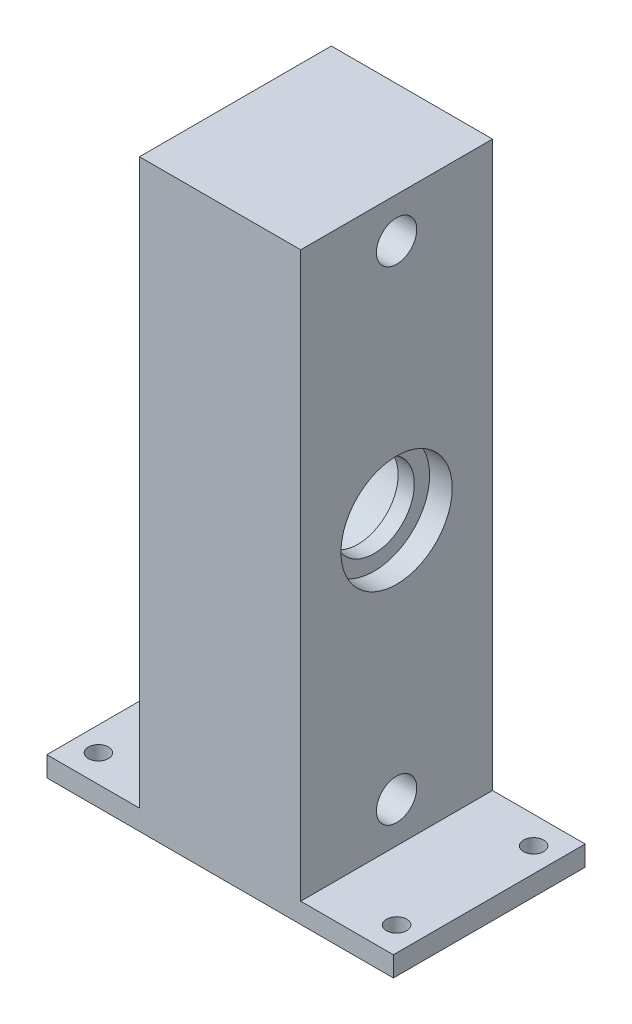
from build123d import *

# Parameters (mm, degrees)
SKETCH1_W           = 25.4
SKETCH1_H           = 88.9
BOSS_EXTRUDE1_DEPTH = 30.226
SKETCH2_R           = 3.175
CUT_EXTRUDE1_DEPTH  = 12.7
SKETCH3_R           = 8.763
CUT_EXTRUDE2_DEPTH  = 3.556
CUT_EXTRUDE3_START  = -21.844
SKETCH4_R           = 10.795
CUT_EXTRUDE3_DEPTH  = 21.844
SKETCH5_W           = 54.61
SKETCH5_H           = 30.226
BOSS_EXTRUDE2_DEPTH = 3.175
SKETCH6_R           = 1.5875
CUT_EXTRUDE4_DEPTH  = 3.175
BOSS_EXTRUDE3_START = 2.54
SKETCH8_R           = 10.795
SKETCH8_R_2         = 6.35
BOSS_EXTRUDE3_DEPTH = 2.54


with BuildPart() as part:
    # Sketch1 → Boss-Extrude1 (new body)
    with BuildSketch(Plane.XY):
        Rectangle(SKETCH1_W, SKETCH1_H)
    extrude(amount=BOSS_EXTRUDE1_DEPTH)

    # Sketch2 → Cut-Extrude1 (cut)
    with BuildSketch(Plane(origin=(12.7, 0, 0), x_dir=(0, 0, -1), z_dir=(1, 0, 0))):
        with Locations((-15.113, 38.1)):
            Circle(SKETCH2_R)
        with Locations((-15.113, -38.1)):
            Circle(SKETCH2_R)
    extrude(amount=-CUT_EXTRUDE1_DEPTH, mode=Mode.SUBTRACT)

    # Sketch3 → Cut-Extrude2 (cut)
    with BuildSketch(Plane(origin=(12.7, 0, 0), x_dir=(0, 0, -1), z_dir=(1, 0, 0))):
        with Locations((-15.113, 0)):
            Circle(SKETCH3_R)
    extrude(amount=-CUT_EXTRUDE2_DEPTH, mode=Mode.SUBTRACT)

    # Sketch4 → Cut-Extrude3 (cut)
    with BuildSketch(Plane(origin=(9.144, 0, 0), x_dir=(0, 0, -1), z_dir=(1, 0, 0)).offset(CUT_EXTRUDE3_START)):
        with Locations((-15.113, 0)):
            Circle(SKETCH4_R)
    extrude(amount=CUT_EXTRUDE3_DEPTH, mode=Mode.SUBTRACT)

    # Sketch5 → Boss-Extrude2 (add)
    with BuildSketch(Plane.XZ.offset(44.45)):
        with Locations((0, 15.113)):
            Rectangle(SKETCH5_W, SKETCH5_H)
    extrude(amount=BOSS_EXTRUDE2_DEPTH)

    # Sketch6 → Cut-Extrude4 (cut)
    with BuildSketch(Plane.XZ.offset(47.625)):
        with Locations(Location((-23.495, 25.908, 0), (0, 0, 270))):
            Circle(SKETCH6_R)
        with Locations(Location((-23.495, 4.318, 0), (0, 0, 270))):
            Circle(SKETCH6_R)
        with Locations(Location((23.495, 4.318, 0), (0, 0, 270))):
            Circle(SKETCH6_R)
        with Locations(Location((23.495, 25.908, 0), (0, 0, 270))):
            Circle(SKETCH6_R)
    extrude(amount=-CUT_EXTRUDE4_DEPTH, mode=Mode.SUBTRACT)

    # Sketch8 → Boss-Extrude3 (add)
    with BuildSketch(Plane.ZY.offset(-9.144).offset(BOSS_EXTRUDE3_START)):
        with Locations(Location((15.113, 0, 0), (0, 0, 180))):
            Circle(SKETCH8_R)
        with Locations((15.113, 0)):
            Circle(SKETCH8_R_2, mode=Mode.SUBTRACT)
    extrude(amount=-BOSS_EXTRUDE3_DEPTH)


solid = part.part
